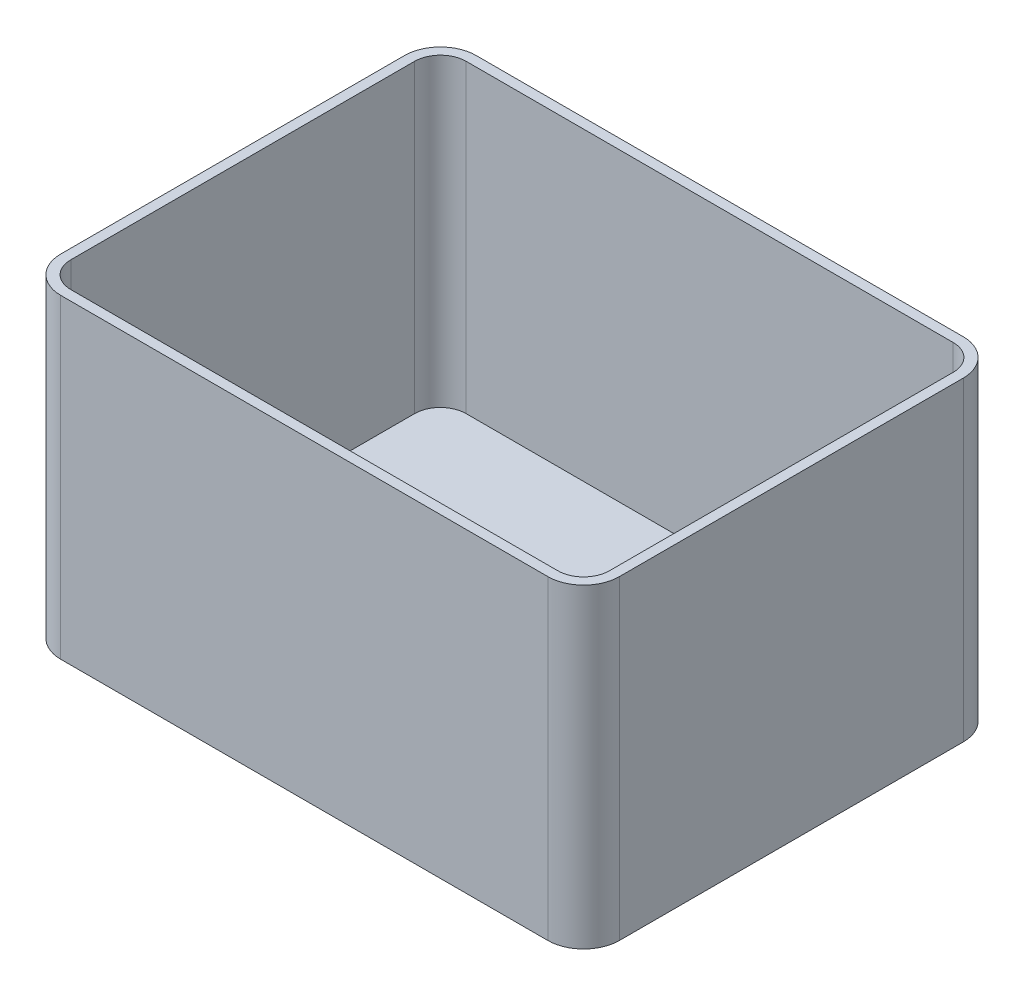
from build123d import *

# Parameters (mm, degrees)
BOSS_EXTRUDE1_DEPTH = 220
SHELL1_T            = -7


with BuildPart() as part:
    # Sketch1 → Boss-Extrude1 (new body)
    with BuildSketch(Plane(origin=(0, 0, 0), x_dir=(1, 0, 0), z_dir=(0, 1, 0))):
        with BuildLine():
            Line((-170, -145), (170, -145))
            ThreePointArc((170, -145), (187.67766953, -137.67766953), (195, -120))
            Line((195, -120), (195, 120))
            ThreePointArc((195, 120), (187.67766953, 137.67766953), (170, 145))
            Line((170, 145), (-170, 145))
            ThreePointArc((-170, 145), (-187.67766953, 137.67766953), (-195, 120))
            Line((-195, 120), (-195, -120))
            ThreePointArc((-195, -120), (-187.67766953, -137.67766953), (-170, -145))
        make_face()
    extrude(amount=BOSS_EXTRUDE1_DEPTH)

    # Shell1
    shell1_openings = [part.faces().sort_by_distance(p)[0] for p in [
        (0, 220, 0),
    ]]
    offset(amount=SHELL1_T, openings=shell1_openings, kind=Kind.INTERSECTION)


solid = part.part
